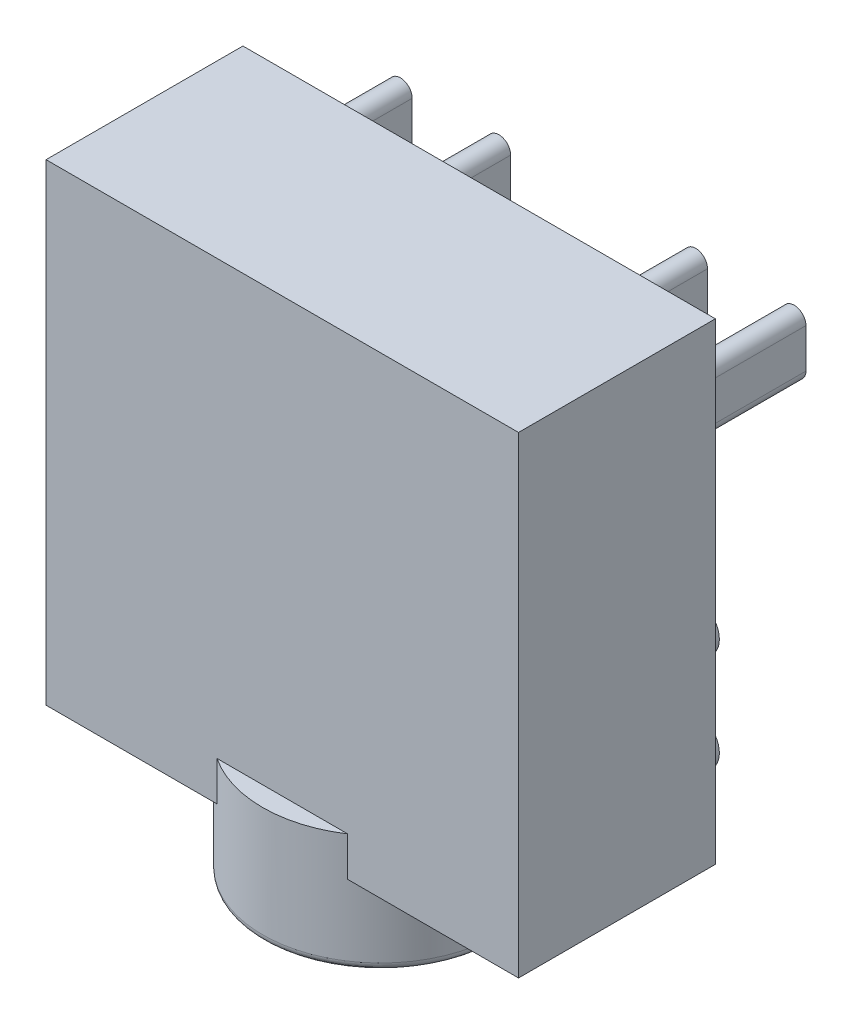
from build123d import *

# Parameters (mm, degrees)
SKETCH1_W                = 12
SKETCH1_H                = 12
BOSS_EXTRUDE1_DEPTH      = 5
BOSS_EXTRUDE2_DEPTH      = 2
BOSS_EXTRUDE2_DEPTH_BACK = 1
SKETCH2_R                = 3
SKETCH2_R_2              = 1.8
FILLET1_R                = 0.2
SKETCH3_R                = 0.6
BOSS_EXTRUDE3_DEPTH      = 0.5
BOSS_EXTRUDE4_DEPTH      = 3


with BuildPart() as part:
    # Sketch1 → Boss-Extrude1 (new body)
    with BuildSketch(Plane.XY):
        Rectangle(SKETCH1_W, SKETCH1_H)
    extrude(amount=BOSS_EXTRUDE1_DEPTH)

    # Sketch2 → Boss-Extrude2 (add, two sides: drawn at the far end of the back side and taken through both)
    with BuildSketch(Plane.XZ.offset(6).offset(-BOSS_EXTRUDE2_DEPTH_BACK)):
        with Locations((0, 2.5)):
            Circle(SKETCH2_R)
        with Locations((0, 2.5)):
            Circle(SKETCH2_R_2, mode=Mode.SUBTRACT)
    extrude(amount=BOSS_EXTRUDE2_DEPTH + BOSS_EXTRUDE2_DEPTH_BACK)

    # Fillet1
    fillet1_edges = [part.edges().sort_by_distance(p)[0] for p in [
        (-1.8, -8, 2.5),
        (-3, -8, 2.5),
    ]]
    fillet(fillet1_edges, radius=FILLET1_R)

    # Sketch3 → Boss-Extrude3 (add)
    with BuildSketch(Plane(origin=(0, 0, 0), x_dir=(-1, 0, 0), z_dir=(0, 0, -1))):
        with Locations((-5, -4)):
            Circle(SKETCH3_R)
        with Locations((5, -4)):
            Circle(SKETCH3_R)
        with Locations((-5, -1.5)):
            Circle(SKETCH3_R)
        with Locations((5, -1.5)):
            Circle(SKETCH3_R)
        with Locations((0, 3.5)):
            Circle(SKETCH3_R)
    extrude(amount=BOSS_EXTRUDE3_DEPTH)

    # Sketch3<3> → Boss-Extrude4 (add)
    with BuildSketch(Plane(origin=(0, 0, 0), x_dir=(-1, 0, 0), z_dir=(0, 0, -1))):
        with BuildLine():
            Line((-0.5, -1.2), (0.5, -1.2))
            ThreePointArc((0.5, -1.2), (0.8, -1.5), (0.5, -1.8))
            Line((0.5, -1.8), (-0.5, -1.8))
            ThreePointArc((-0.5, -1.8), (-0.8, -1.5), (-0.5, -1.2))
        make_face()
        with BuildLine():
            Line((-4.7, 4), (-4.7, 3))
            ThreePointArc((-4.7, 3), (-5, 2.7), (-5.3, 3))
            Line((-5.3, 3), (-5.3, 4))
            ThreePointArc((-5.3, 4), (-5, 4.3), (-4.7, 4))
        make_face()
        with BuildLine():
            Line((-2.2, 4), (-2.2, 3))
            ThreePointArc((-2.2, 3), (-2.5, 2.7), (-2.8, 3))
            Line((-2.8, 3), (-2.8, 4))
            ThreePointArc((-2.8, 4), (-2.5, 4.3), (-2.2, 4))
        make_face()
        with BuildLine():
            Line((4.7, 4), (4.7, 3))
            ThreePointArc((4.7, 3), (5, 2.7), (5.3, 3))
            Line((5.3, 3), (5.3, 4))
            ThreePointArc((5.3, 4), (5, 4.3), (4.7, 4))
        make_face()
        with BuildLine():
            Line((2.2, 4), (2.2, 3))
            ThreePointArc((2.2, 3), (2.5, 2.7), (2.8, 3))
            Line((2.8, 3), (2.8, 4))
            ThreePointArc((2.8, 4), (2.5, 4.3), (2.2, 4))
        make_face()
    extrude(amount=BOSS_EXTRUDE4_DEPTH)


solid = part.part
